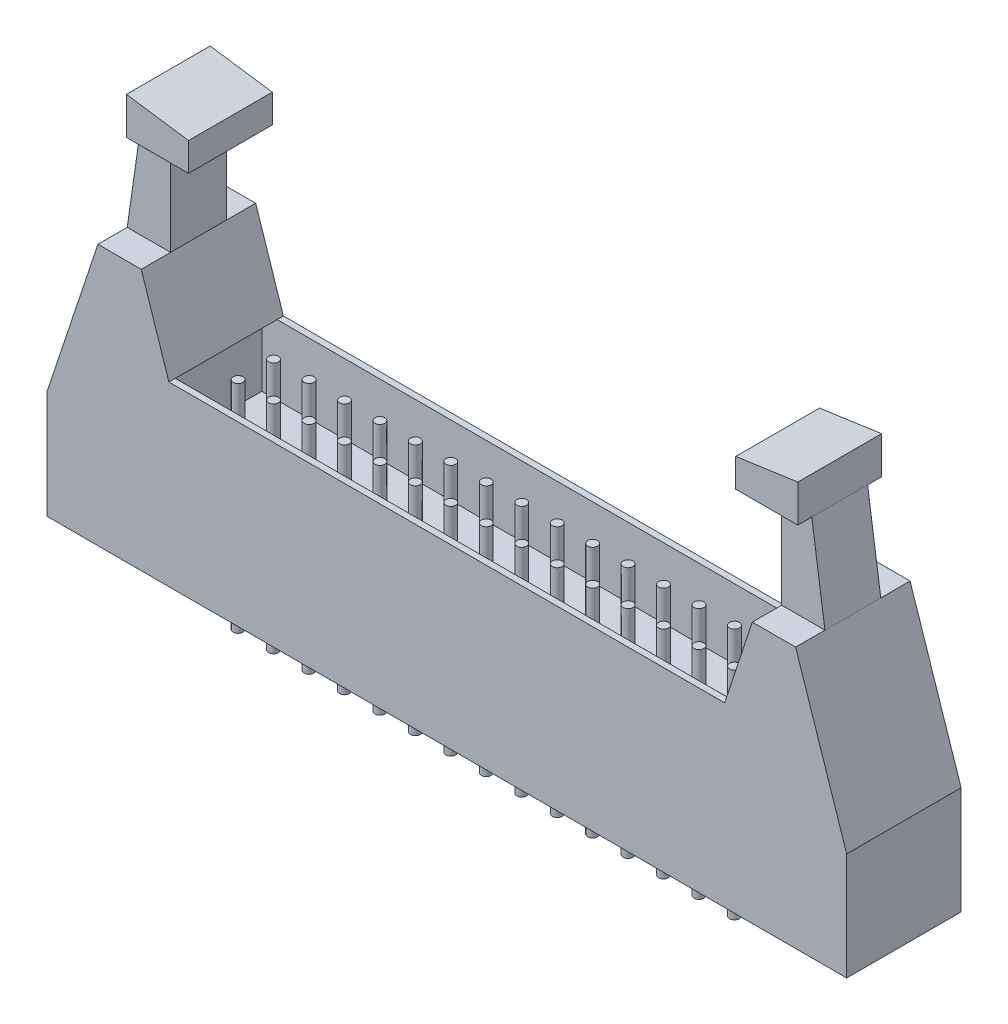
from build123d import *

# Parameters (mm, degrees)
EXTRUDE_1_DEPTH      = 4.1
EXTRUDE_1_DEPTH_BACK = 4.1
SKETCH_3_W           = 42
SKETCH_3_H           = 7.294129616
CUT_EXTRUDE_1_DEPTH  = 5
EXTRUDE_2_DEPTH      = 2
EXTRUDE_2_DEPTH_BACK = 2
EXTRUDE_3_DEPTH      = 3
EXTRUDE_3_DEPTH_BACK = 3
EXTRUDE_4_DEPTH      = 3
EXTRUDE_4_DEPTH_BACK = 12.5
SKETCH_6_R           = 0.35


with BuildPart() as part:
    # Эскиз2 → Бобышка-Вытянуть1 (new, two sides: drawn at the far end of the back side and taken through both)
    with BuildSketch(Plane.XY.offset(-EXTRUDE_1_DEPTH_BACK)):
        Polygon((21.889579694, 14.852543655), (19.907114806, 8.85), (-19.907114806, 8.85), (-21.889579694, 14.852543655), (-24.992568214, 14.852543655), (-28.65, 3.85), (-28.65, -3.85), (28.65, -3.85), (28.65, 3.85), (24.992568214, 14.852543655), align=None)
    extrude(amount=EXTRUDE_1_DEPTH + EXTRUDE_1_DEPTH_BACK)

    # Эскиз3 → Вырез-Вытянуть1 (cut)
    with BuildSketch(Plane(origin=(0, 8.85, 0), x_dir=(1, 0, 0), z_dir=(0, 1, 0))):
        Rectangle(SKETCH_3_W, SKETCH_3_H)
    extrude(amount=-CUT_EXTRUDE_1_DEPTH, mode=Mode.SUBTRACT)

    # Эскиз4 → Бобышка-Вытянуть2 (add, two sides: drawn at the far end of the back side and taken through both)
    with BuildSketch(Plane.XY.offset(-EXTRUDE_2_DEPTH_BACK)):
        Polygon((-24.992568214, 14.852543655), (-21.889579694, 14.852543655), (-21.889579694, 21.400452047), (-24.052396461, 21.400452047), align=None)
        Polygon((24.052396461, 21.400452047), (24.992568214, 14.852543655), (21.889579694, 14.852543655), (21.889579694, 21.400452047), align=None)
    extrude(amount=EXTRUDE_2_DEPTH + EXTRUDE_2_DEPTH_BACK)

    # Эскиз5 → Бобышка-Вытянуть3 (add, two sides: drawn at the far end of the back side and taken through both)
    with BuildSketch(Plane.XY.offset(-EXTRUDE_3_DEPTH_BACK)):
        Polygon((-24.052396461, 21.400452047), (-24.052396461, 24.074868015), (-19.60201978, 23.435867253), (-19.60201978, 21.400452047), (-21.889579694, 21.400452047), align=None)
        Polygon((19.60201978, 21.400452047), (21.889579694, 21.400452047), (24.052396461, 21.400452047), (24.052396461, 24.074868015), (19.60201978, 23.435867253), align=None)
    extrude(amount=EXTRUDE_3_DEPTH + EXTRUDE_3_DEPTH_BACK)

    # Эскиз6 → Бобышка-Вытянуть4 (add, two sides: drawn at the far end of the back side and taken through both)
    with BuildSketch(Plane.XZ.offset(3.85).offset(-EXTRUDE_4_DEPTH_BACK)):
        with Locations((0, 1.27)):
            Circle(SKETCH_6_R)
        with Locations((0, -1.27)):
            Circle(SKETCH_6_R)
        with Locations((2.54, -1.27)):
            Circle(SKETCH_6_R)
        with Locations((2.54, 1.27)):
            Circle(SKETCH_6_R)
        with Locations((5.08, -1.27)):
            Circle(SKETCH_6_R)
        with Locations((5.08, 1.27)):
            Circle(SKETCH_6_R)
        with Locations((7.62, -1.27)):
            Circle(SKETCH_6_R)
        with Locations((7.62, 1.27)):
            Circle(SKETCH_6_R)
        with Locations((10.16, -1.27)):
            Circle(SKETCH_6_R)
        with Locations((10.16, 1.27)):
            Circle(SKETCH_6_R)
        with Locations((12.7, -1.27)):
            Circle(SKETCH_6_R)
        with Locations((12.7, 1.27)):
            Circle(SKETCH_6_R)
        with Locations((15.24, -1.27)):
            Circle(SKETCH_6_R)
        with Locations((15.24, 1.27)):
            Circle(SKETCH_6_R)
        with Locations((17.78, -1.27)):
            Circle(SKETCH_6_R)
        with Locations((17.78, 1.27)):
            Circle(SKETCH_6_R)
        with Locations((-2.54, -1.27)):
            Circle(SKETCH_6_R)
        with Locations((-2.54, 1.27)):
            Circle(SKETCH_6_R)
        with Locations((-5.08, -1.27)):
            Circle(SKETCH_6_R)
        with Locations((-5.08, 1.27)):
            Circle(SKETCH_6_R)
        with Locations((-7.62, -1.27)):
            Circle(SKETCH_6_R)
        with Locations((-7.62, 1.27)):
            Circle(SKETCH_6_R)
        with Locations((-10.16, -1.27)):
            Circle(SKETCH_6_R)
        with Locations((-10.16, 1.27)):
            Circle(SKETCH_6_R)
        with Locations((-12.7, -1.27)):
            Circle(SKETCH_6_R)
        with Locations((-12.7, 1.27)):
            Circle(SKETCH_6_R)
        with Locations((-15.24, -1.27)):
            Circle(SKETCH_6_R)
        with Locations((-15.24, 1.27)):
            Circle(SKETCH_6_R)
        with Locations((-17.78, -1.27)):
            Circle(SKETCH_6_R)
        with Locations((-17.78, 1.27)):
            Circle(SKETCH_6_R)
    extrude(amount=EXTRUDE_4_DEPTH + EXTRUDE_4_DEPTH_BACK)


solid = part.part
